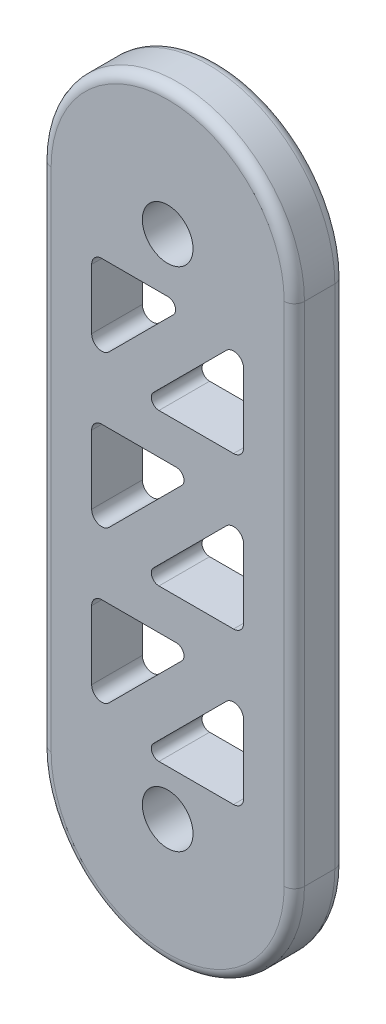
from build123d import *

# Parameters (mm, degrees)
SKETCH1_R           = 5
BOSS_EXTRUDE1_DEPTH = 10
CUT_EXTRUDE2_DEPTH  = 10
FILLET1_R           = 2
FILLET2_R           = 2


with BuildPart() as part:
    # Sketch1 → Boss-Extrude1 (new body)
    # profile 1 of 2: a face of its own
    with BuildSketch(Plane.XY):
        with BuildLine():
            Line((0, 0), (0, 100))
            ThreePointArc((0, 100), (25, 125), (50, 100))
            Line((50, 100), (50, 0))
            ThreePointArc((50, 0), (25, -25), (0, 0))
        make_face()
        with BuildLine():
            ThreePointArc((15, 0), (25, -10), (35, 0))
            Line((35, 0), (35, 100))
            ThreePointArc((35, 100), (25, 110), (15, 100))
            Line((15, 100), (15, 0))
        make_face(mode=Mode.SUBTRACT)
    # profile 2 of 2: a face of its own
    with BuildSketch(Plane.XY):
        with BuildLine():
            Line((15, 0), (15, 100))
            ThreePointArc((15, 100), (25, 110), (35, 100))
            Line((35, 100), (35, 0))
            ThreePointArc((35, 0), (25, -10), (15, 0))
        make_face()
        with Locations((25, 0)):
            Circle(SKETCH1_R, mode=Mode.SUBTRACT)
        with Locations((25, 100)):
            Circle(SKETCH1_R, mode=Mode.SUBTRACT)
    extrude(amount=BOSS_EXTRUDE1_DEPTH)

    # Sketch2 → Cut-Extrude2 (cut)
    with BuildSketch(Plane.XY.offset(10)):
        with BuildLine():
            Line((25.064971157, 89.343145751), (10, 89.343145751))
            Line((10, 89.343145751), (10, 70.656854249))
            Line((10, 70.656854249), (26.125631329, 86.782485579))
            ThreePointArc((26.125631329, 86.782485579), (26.450790456, 88.417170899), (25.064971157, 89.343145751))
        make_face()
        with BuildLine():
            Line((40, 69), (40, 89.343145751))
            Line((40, 89.343145751), (22.217514421, 71.560660172))
            ThreePointArc((22.217514421, 71.560660172), (21.892355294, 69.925974851), (23.278174593, 69))
            Line((23.278174593, 69), (40, 69))
        make_face()
        with BuildLine():
            Line((26.721825407, 61), (10, 61))
            Line((10, 61), (10, 40.65685425))
            Line((10, 40.65685425), (22.171572875, 52.828427125))
            Line((22.171572875, 52.828427125), (27.782485579, 58.439339828))
            ThreePointArc((27.782485579, 58.439339828), (28.107644706, 60.074025149), (26.721825407, 61))
        make_face()
        with BuildLine():
            Line((40, 39), (40, 59.343145751))
            Line((40, 59.343145751), (27.828427125, 47.171572875))
            Line((27.828427125, 47.171572875), (22.217514421, 41.560660172))
            ThreePointArc((22.217514421, 41.560660172), (21.892355294, 39.925974852), (23.278174593, 39))
            Line((23.278174593, 39), (40, 39))
        make_face()
        with BuildLine():
            Line((26.721825408, 31.000000001), (10, 31.000000001))
            Line((10, 31.000000001), (10, 10.656854249))
            Line((10, 10.656854249), (27.782485579, 28.439339829))
            ThreePointArc((27.782485579, 28.439339829), (28.107644706, 30.074025149), (26.721825408, 31.000000001))
        make_face()
        with BuildLine():
            Line((40, 9), (40, 29.34314575))
            Line((40, 29.34314575), (22.217514422, 11.560660171))
            ThreePointArc((22.217514422, 11.560660171), (21.892355295, 9.925974851), (23.278174594, 9))
            Line((23.278174594, 9), (40, 9))
        make_face()
    extrude(amount=-CUT_EXTRUDE2_DEPTH, mode=Mode.SUBTRACT)

    # Fillet1
    fillet1_edges = [part.edges().sort_by_distance(p)[0] for p in [
        (10, 10.656854249, 5),
        (10, 31.000000001, 5),
        (40, 59.343145751, 5),
        (40, 39, 5),
        (10, 40.65685425, 5),
        (10, 61, 5),
        (40, 89.343145751, 5),
        (40, 69, 5),
        (40, 29.34314575, 5),
        (40, 9, 5),
        (10, 70.656854249, 5),
        (10, 89.343145751, 5),
    ]]
    fillet(fillet1_edges, radius=FILLET1_R)

    # Fillet2
    fillet2_edges = [part.edges().sort_by_distance(p)[0] for p in [
        (25, -25, 0),
        (0, 50, 0),
        (25, -25, 10),
        (50, 50, 10),
        (25, 125, 10),
        (0, 50, 10),
        (25, 125, 0),
        (50, 50, 0),
    ]]
    fillet(fillet2_edges, radius=FILLET2_R)


solid = part.part
